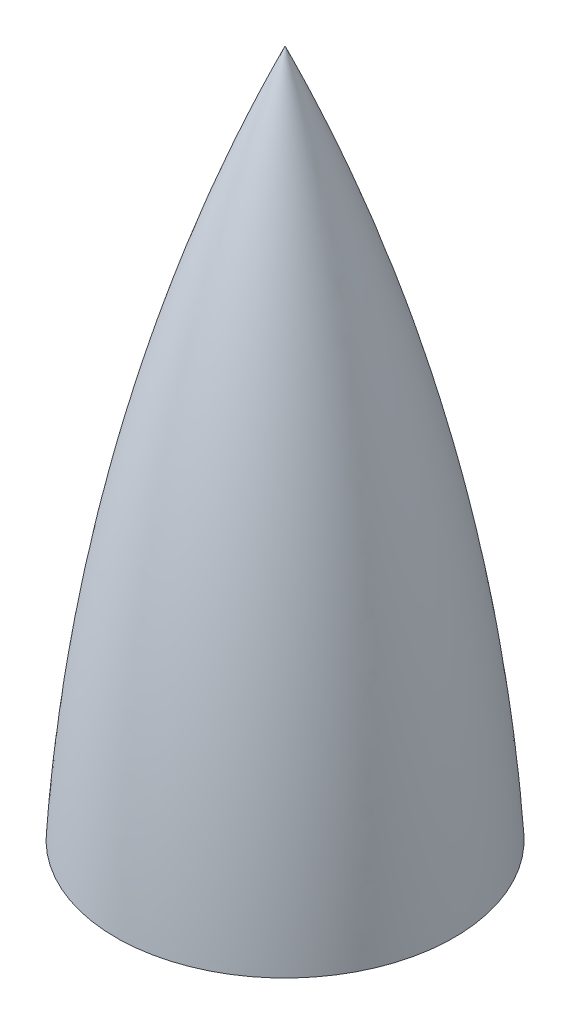
from build123d import *


with BuildPart() as part:
    # Sketch2 → Revolve1 (revolve)
    with BuildSketch(Plane.XY):
        with BuildLine():
            Line((-93.6498, 0), (-88.9, 0))
            ThreePointArc((-88.9, 0), (-59.590343886, 191.54048673), (0, 375.92))
            Line((0, 375.92), (0, 381))
            ThreePointArc((0, 381), (-64.054413952, 194.735014529), (-93.6498, 0))
        make_face()
    revolve(axis=Axis((0, 381, 0), (0, -1, 0)))


solid = part.part
